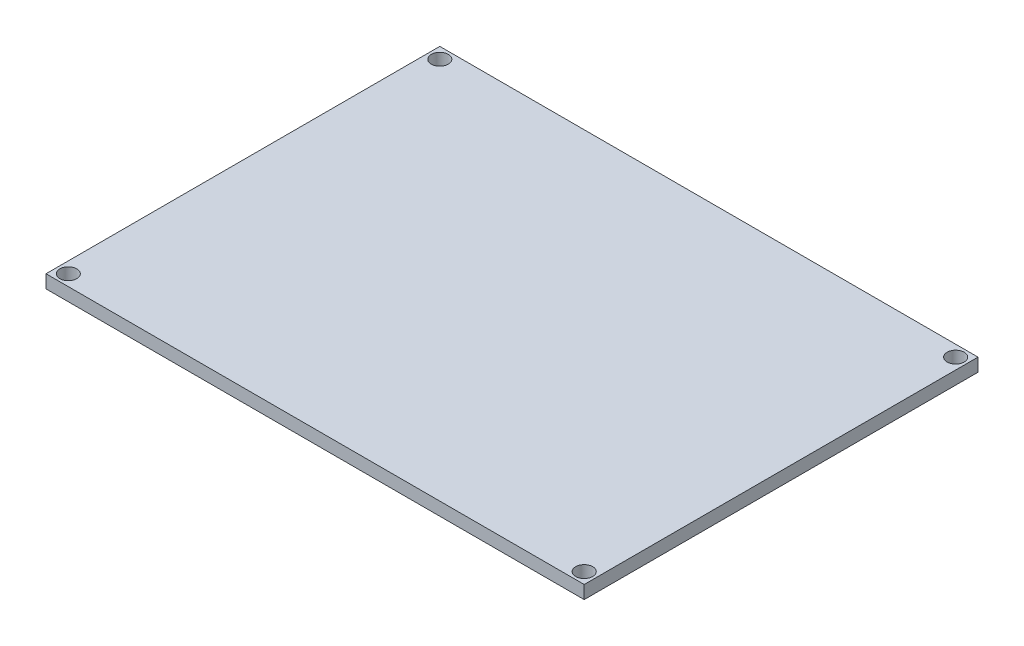
from build123d import *

# Parameters (mm, degrees)
SKETCH1_W           = 82
SKETCH1_H           = 60
SKETCH1_R           = 1.3
BOSS_EXTRUDE1_DEPTH = 2


with BuildPart() as part:
    # Sketch1 → Boss-Extrude1 (new body)
    with BuildSketch(Plane(origin=(0, 0, 0), x_dir=(1, 0, 0), z_dir=(0, 1, 0))):
        with Locations((41, -30)):
            Rectangle(SKETCH1_W, SKETCH1_H)
        with Locations(Location((80.3, -58.3, 0), (0, 0, 270))):
            Circle(SKETCH1_R, mode=Mode.SUBTRACT)
        with Locations(Location((80.3, -1.7, 0), (0, 0, 270))):
            Circle(SKETCH1_R, mode=Mode.SUBTRACT)
        with Locations(Location((1.7, -1.7, 0), (0, 0, 270))):
            Circle(SKETCH1_R, mode=Mode.SUBTRACT)
        with Locations(Location((1.7, -58.3, 0), (0, 0, 270))):
            Circle(SKETCH1_R, mode=Mode.SUBTRACT)
    extrude(amount=BOSS_EXTRUDE1_DEPTH)


solid = part.part
